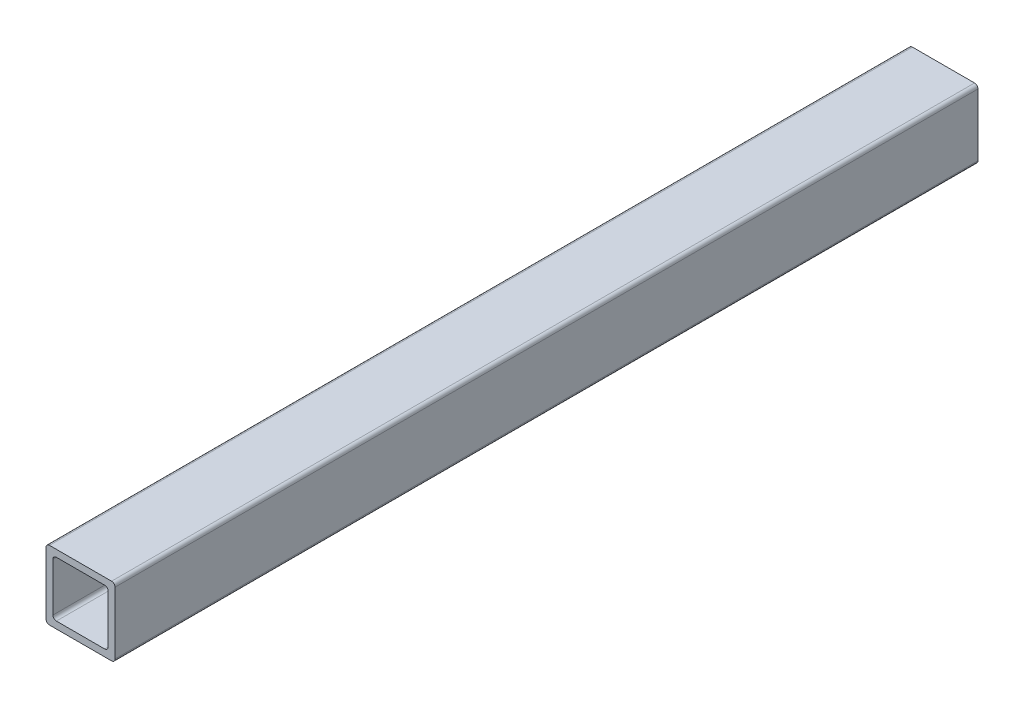
from build123d import *

# Parameters (mm, degrees)
BOSS_EXTRU_1_DEPTH = 500


with BuildPart() as part:
    # Esquisse2 → Boss.-Extru.1 (new body)
    with BuildSketch(Plane.XY):
        with BuildLine():
            Line((2, 0), (38, 0))
            ThreePointArc((38, 0), (39.414213562, 0.585786438), (40, 2))
            Line((40, 2), (40, 38))
            ThreePointArc((40, 38), (39.414213562, 39.414213562), (38, 40))
            Line((38, 40), (2, 40))
            ThreePointArc((2, 40), (0.585786438, 39.414213562), (0, 38))
            Line((0, 38), (0, 2))
            ThreePointArc((0, 2), (0.585786438, 0.585786438), (2, 0))
        make_face()
        with BuildLine():
            Line((6, 4), (34, 4))
            ThreePointArc((34, 4), (35.414213562, 4.585786438), (36, 6))
            Line((36, 6), (36, 34))
            ThreePointArc((36, 34), (35.414213562, 35.414213562), (34, 36))
            Line((34, 36), (6, 36))
            ThreePointArc((6, 36), (4.585786438, 35.414213562), (4, 34))
            Line((4, 34), (4, 6))
            ThreePointArc((4, 6), (4.585786438, 4.585786438), (6, 4))
        make_face(mode=Mode.SUBTRACT)
    extrude(amount=BOSS_EXTRU_1_DEPTH)


solid = part.part
